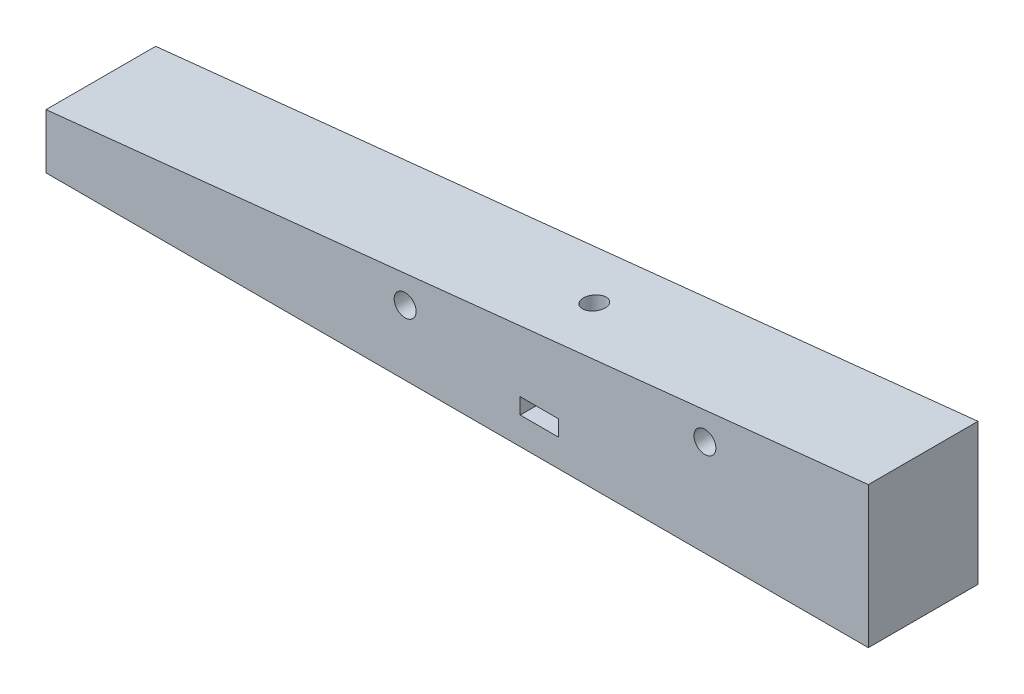
from build123d import *

# Parameters (mm, degrees)
SKETCH1_W               = 150
SKETCH1_H               = 20
BOSS_EXTRUDE1_DEPTH     = 10
BOSS_EXTRUDE2_DEPTH     = 10
CUT_EXTRUDE1_DEPTH      = 80.930394481
CUT_EXTRUDE1_DEPTH_BACK = 80.930394481
SKETCH3_R               = 2
SKETCH4_W               = 7
SKETCH4_H               = 2.9
CUT_EXTRUDE2_DEPTH      = 13.8
CUT_EXTRUDE3_DEPTH      = 82.785499704
CUT_EXTRUDE3_DEPTH_BACK = 82.785499704
SKETCH4_3_R             = 2


with BuildPart() as part:
    # Sketch1 → Boss-Extrude1 (new body)
    with BuildSketch(Plane(origin=(0, 0, 0), x_dir=(1, 0, 0), z_dir=(0, 1, 0))):
        Rectangle(SKETCH1_W, SKETCH1_H)
    extrude(amount=BOSS_EXTRUDE1_DEPTH)

    # Sketch2 → Boss-Extrude2 (add, symmetric)
    with BuildSketch(Plane.XY):
        Polygon((-75, 10), (75, 10), (75, 25.76563529), align=None)
    extrude(amount=BOSS_EXTRUDE2_DEPTH, both=True)

    # Sketch3 → Cut-Extrude1 (cut, two sides: drawn at the far end of the back side and taken through both)
    with BuildSketch(Plane.XZ.offset(-CUT_EXTRUDE1_DEPTH_BACK)):
        with Locations((15, 0)):
            Circle(SKETCH3_R)
    extrude(amount=CUT_EXTRUDE1_DEPTH + CUT_EXTRUDE1_DEPTH_BACK, mode=Mode.SUBTRACT)

    # Sketch4 → Cut-Extrude2 (cut)
    with BuildSketch(Plane.XY.offset(10)):
        with Locations((15, 6.45)):
            Rectangle(SKETCH4_W, SKETCH4_H)
    extrude(amount=-CUT_EXTRUDE2_DEPTH, mode=Mode.SUBTRACT)

    # Sketch4<3> → Cut-Extrude3 (cut, two sides: drawn at the far end of the back side and taken through both)
    with BuildSketch(Plane.XY.offset(10).offset(-CUT_EXTRUDE3_DEPTH_BACK)):
        with Locations((-9.492687022, 11.857554637)):
            Circle(SKETCH4_3_R)
        with Locations((45.186458968, 17.604564461)):
            Circle(SKETCH4_3_R)
    extrude(amount=CUT_EXTRUDE3_DEPTH + CUT_EXTRUDE3_DEPTH_BACK, mode=Mode.SUBTRACT)


solid = part.part
